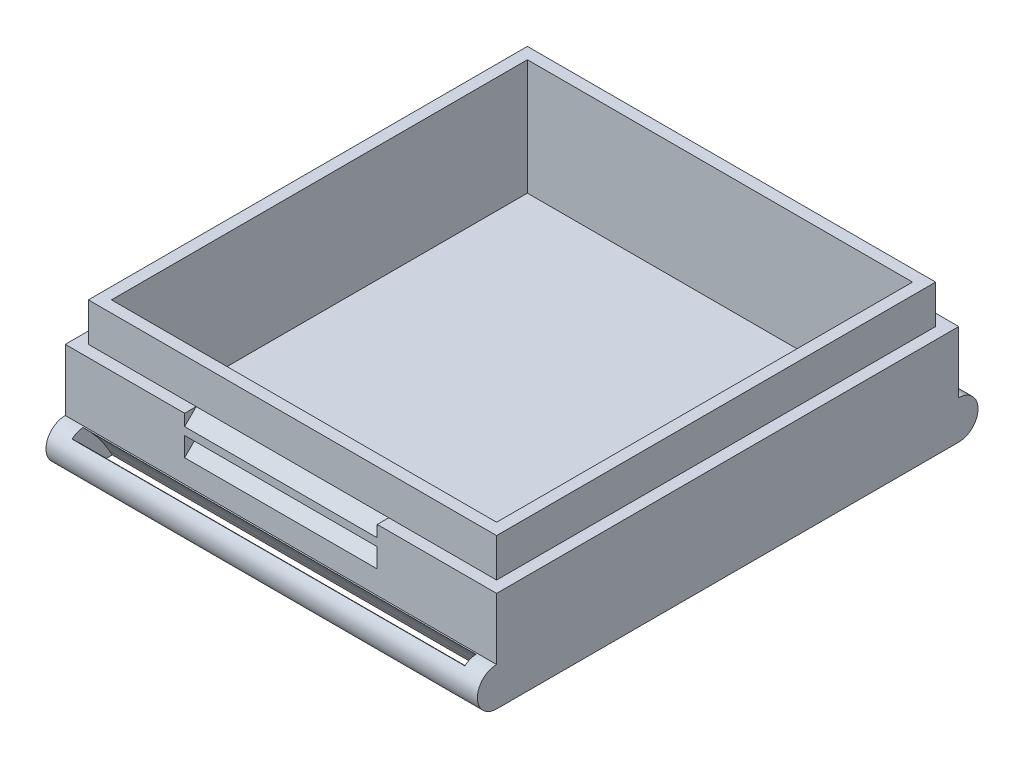
from build123d import *

# Parameters (mm, degrees)
SKETCH1_W                       = 56
SKETCH1_H                       = 60
SKETCH1_W_2                     = 50
SKETCH1_H_2                     = 54
BOSS_EXTRUDE1_DEPTH             = 10
SKETCH2_W                       = 56
SKETCH2_H                       = 60
BOSS_EXTRUDE2_DEPTH             = 3
CUT_EXTRUDE1_DEPTH              = 12.5
BOSS_EXTRUDE4_REACH             = 44.237
BOSS_EXTRUDE4_DIRECTION_2_REACH = 44.237
BOSS_EXTRUDE5_DEPTH             = 25.5
SKETCH7_W                       = 53
SKETCH7_H                       = 57
SKETCH7_W_2                     = 50
SKETCH7_H_2                     = 54
BOSS_EXTRUDE6_DEPTH             = 5


with BuildPart() as part:
    # Sketch1 → Boss-Extrude1 (new body)
    with BuildSketch(Plane(origin=(0, 0, 0), x_dir=(1, 0, 0), z_dir=(0, 1, 0))):
        Rectangle(SKETCH1_W, SKETCH1_H)
        Rectangle(SKETCH1_W_2, SKETCH1_H_2, mode=Mode.SUBTRACT)
    extrude(amount=BOSS_EXTRUDE1_DEPTH)

    # Sketch2 → Boss-Extrude2 (add)
    with BuildSketch(Plane.XZ):
        Rectangle(SKETCH2_W, SKETCH2_H)
    extrude(amount=BOSS_EXTRUDE2_DEPTH)

    # Sketch3 → Cut-Extrude1 (cut, symmetric)
    with BuildSketch(Plane(origin=(0, 0, 0), x_dir=(0, 0, -1), z_dir=(1, 0, 0))):
        Polygon((-28.5, 10), (-31, 10), (-31, 4), (-28.5, 6.5), (-28.5, 7.5), (-30, 7.5), (-30, 8.5), align=None)
    cut_extrude1 = extrude(amount=CUT_EXTRUDE1_DEPTH, both=True, mode=Mode.SUBTRACT)

    # Mirror1: Cut-Extrude1 across plane
    add(cut_extrude1.mirror(Plane.XY), mode=Mode.SUBTRACT)

    # Boss-Extrude4: up to this face of the body (flat: up to its plane)
    boss_extrude4_end = Plane(part.part.faces().sort_by_distance((28, 3.5, 0))[0])
    # Sketch4 → Boss-Extrude4 (add, up to the picked face)
    with BuildSketch(Plane(origin=(0, 0, 0), x_dir=(0, 0, -1), z_dir=(1, 0, 0)), mode=Mode.PRIVATE) as boss_extrude4_sk1:
        with BuildLine():
            Line((30, 2), (30, -3))
            ThreePointArc((30, -3), (32.5, -0.5), (30, 2))
        make_face()
    boss_extrude4_tool1 = split(extrude(boss_extrude4_sk1.sketch, amount=BOSS_EXTRUDE4_REACH, mode=Mode.PRIVATE), bisect_by=boss_extrude4_end, keep=Keep.BOTH, mode=Mode.PRIVATE)
    boss_extrude4 = boss_extrude4_tool1.solids().sort_by(Axis((0, -0.5, -31.061033), (1, 0, 0)))[0]
    add(boss_extrude4)

    # Boss-Extrude4 direction 2: up to this face of the body (flat: up to its plane)
    boss_extrude4_direction_2_end = Plane(part.part.faces().sort_by_distance((-28, 3.5, 0))[0])
    # Sketch4 → Boss-Extrude4 direction 2 (add, up to the picked face)
    with BuildSketch(Plane(origin=(0, 0, 0), x_dir=(0, 0, -1), z_dir=(1, 0, 0)), mode=Mode.PRIVATE) as boss_extrude4_direction_2_sk1:
        with BuildLine():
            Line((30, 2), (30, -3))
            ThreePointArc((30, -3), (32.5, -0.5), (30, 2))
        make_face()
    boss_extrude4_direction_2_tool1 = split(extrude(boss_extrude4_direction_2_sk1.sketch, amount=-BOSS_EXTRUDE4_DIRECTION_2_REACH, mode=Mode.PRIVATE), bisect_by=boss_extrude4_direction_2_end, keep=Keep.BOTH, mode=Mode.PRIVATE)
    boss_extrude4_direction_2 = boss_extrude4_direction_2_tool1.solids().sort_by(Axis((0, -0.5, -31.061033), (-1, 0, 0)))[0]
    add(boss_extrude4_direction_2)

    # Mirror3: Boss-Extrude4, Boss-Extrude4 direction 2 across plane
    add(boss_extrude4.mirror(Plane.XY))
    add(boss_extrude4_direction_2.mirror(Plane.XY))

    # Sketch7 → Boss-Extrude6 (add)
    with BuildSketch(Plane(origin=(0, 10, 0), x_dir=(1, 0, 0), z_dir=(0, 1, 0))):
        Rectangle(SKETCH7_W, SKETCH7_H)
        Rectangle(SKETCH7_W_2, SKETCH7_H_2, mode=Mode.SUBTRACT)
    extrude(amount=BOSS_EXTRUDE6_DEPTH)


with BuildPart() as body_2:
    # Sketch5 → Boss-Extrude5 (new, symmetric)
    with BuildSketch(Plane(origin=(0, 0, 0), x_dir=(0, 0, -1), z_dir=(1, 0, 0))):
        with BuildLine():
            Line((26.787564435, -2.3), (26.383419246, -3))
            Line((26.383419246, -3), (28, -3))
            ThreePointArc((28, -3), (29.996934481, -0.214678652), (32.5, 2.126352177))
            Line((32.5, 2.126352177), (32.5, 3.852866185))
            ThreePointArc((32.5, 3.852866185), (29.29668765, 1.098682153), (26.787564435, -2.3))
        make_face()
    extrude(amount=BOSS_EXTRUDE5_DEPTH, both=True)


with BuildPart() as body_3:
    # Mirror2: mirrored copy
    add(body_2.part.mirror(Plane.XY))


with BuildPart() as part_1:
    add(part.part)

    # Combine1: cut body 2, body 3
    add(body_2.part, mode=Mode.SUBTRACT)
    add(body_3.part, mode=Mode.SUBTRACT)


solid = part_1.part
